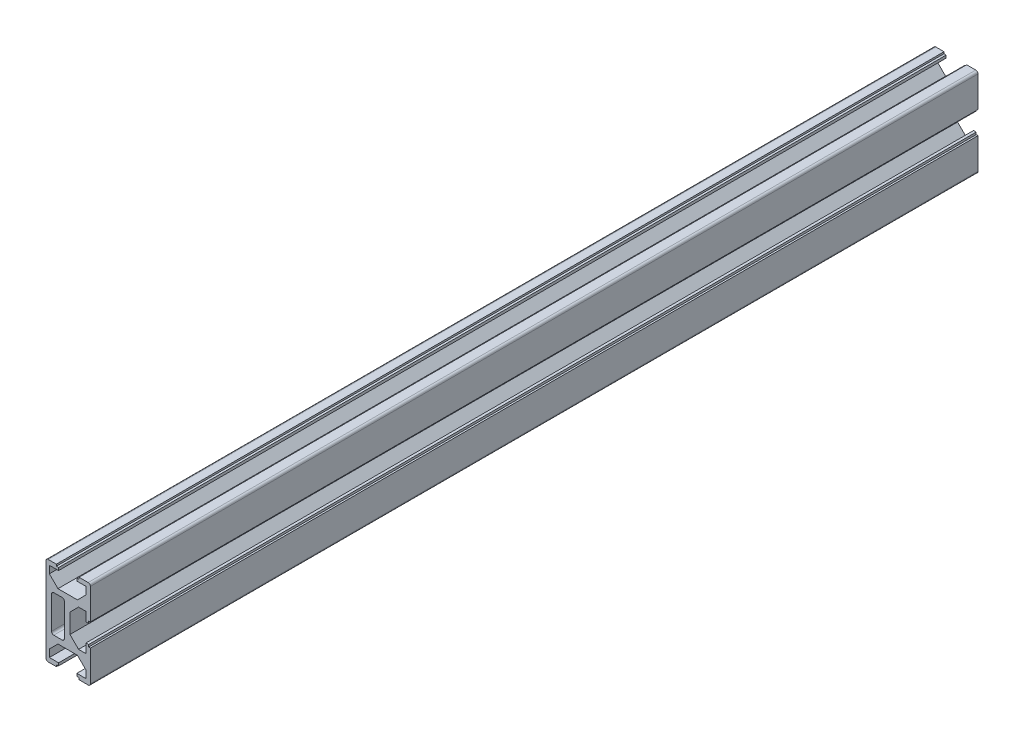
from build123d import *

# Parameters (mm, degrees)
EXTRUDE_3_DEPTH = 400


with BuildPart() as part:
    # 草图30 → 凸台-拉伸3 (new body)
    with BuildSketch(Plane.XY):
        with BuildLine():
            Line((0.8, 4.385786438), (4.664213562, 8.25))
            Line((4.664213562, 8.25), (8, 8.25))
            Line((8, 8.25), (8, 4.1))
            Line((8, 4.1), (9.2, 4.1))
            Line((9.2, 4.1), (9.2, 5.1))
            Line((9.2, 5.1), (10, 5.1))
            Line((10, 5.1), (10, 19))
            ThreePointArc((10, 19), (9.707106781, 19.707106781), (9, 20))
            Line((9, 20), (4.878384215, 20))
            Line((4.878384215, 20), (4.878384215, 19.2))
            Line((4.878384215, 19.2), (3.878384215, 19.2))
            Line((3.878384215, 19.2), (3.878384215, 18))
            Line((3.878384215, 18), (8.028384215, 18))
            Line((8.028384215, 18), (8.028384215, 14.664213562))
            Line((8.028384215, 14.664213562), (4.164170652, 10.8))
            Line((4.164170652, 10.8), (-4.607402223, 10.8))
            Line((-4.607402223, 10.8), (-8.471615785, 14.664213562))
            Line((-8.471615785, 14.664213562), (-8.471615785, 18))
            Line((-8.471615785, 18), (-4.321615785, 18))
            Line((-4.321615785, 18), (-4.321615785, 19.2))
            Line((-4.321615785, 19.2), (-5.321615785, 19.2))
            Line((-5.321615785, 19.2), (-5.321615785, 20))
            Line((-5.321615785, 20), (-9, 20))
            ThreePointArc((-9, 20), (-9.707106781, 19.707106781), (-10, 19))
            Line((-10, 19), (-10, -19))
            ThreePointArc((-10, -19), (-9.707106781, -19.707106781), (-9, -20))
            Line((-9, -20), (-5.321615785, -20))
            Line((-5.321615785, -20), (-5.321615785, -19.2))
            Line((-5.321615785, -19.2), (-4.321615785, -19.2))
            Line((-4.321615785, -19.2), (-4.321615785, -18))
            Line((-4.321615785, -18), (-8.471615785, -18))
            Line((-8.471615785, -18), (-8.471615785, -14.664213562))
            Line((-8.471615785, -14.664213562), (-4.607402223, -10.8))
            Line((-4.607402223, -10.8), (4.164170652, -10.8))
            Line((4.164170652, -10.8), (8.028384215, -14.664213562))
            Line((8.028384215, -14.664213562), (8.028384215, -18))
            Line((8.028384215, -18), (3.878384215, -18))
            Line((3.878384215, -18), (3.878384215, -19.2))
            Line((3.878384215, -19.2), (4.878384215, -19.2))
            Line((4.878384215, -19.2), (4.878384215, -20))
            Line((4.878384215, -20), (9, -20))
            ThreePointArc((9, -20), (9.707106781, -19.707106781), (10, -19))
            Line((10, -19), (10, -5.1))
            Line((10, -5.1), (9.2, -5.1))
            Line((9.2, -5.1), (9.2, -4.1))
            Line((9.2, -4.1), (8, -4.1))
            Line((8, -4.1), (8, -8.25))
            Line((8, -8.25), (4.664213562, -8.25))
            Line((4.664213562, -8.25), (0.8, -4.385786438))
            Line((0.8, -4.385786438), (0.8, 4.385786438))
        make_face()
        with BuildLine():
            Line((-1.7, 7.3), (-1.7, -7.3))
            ThreePointArc((-1.7, -7.3), (-1.992893219, -8.007106781), (-2.7, -8.3))
            Line((-2.7, -8.3), (-6.5, -8.3))
            ThreePointArc((-6.5, -8.3), (-7.207106781, -8.007106781), (-7.5, -7.3))
            Line((-7.5, -7.3), (-7.5, 7.3))
            ThreePointArc((-7.5, 7.3), (-7.207106781, 8.007106781), (-6.5, 8.3))
            Line((-6.5, 8.3), (-2.7, 8.3))
            ThreePointArc((-2.7, 8.3), (-1.992893219, 8.007106781), (-1.7, 7.3))
        make_face(mode=Mode.SUBTRACT)
    extrude(amount=EXTRUDE_3_DEPTH)


solid = part.part
